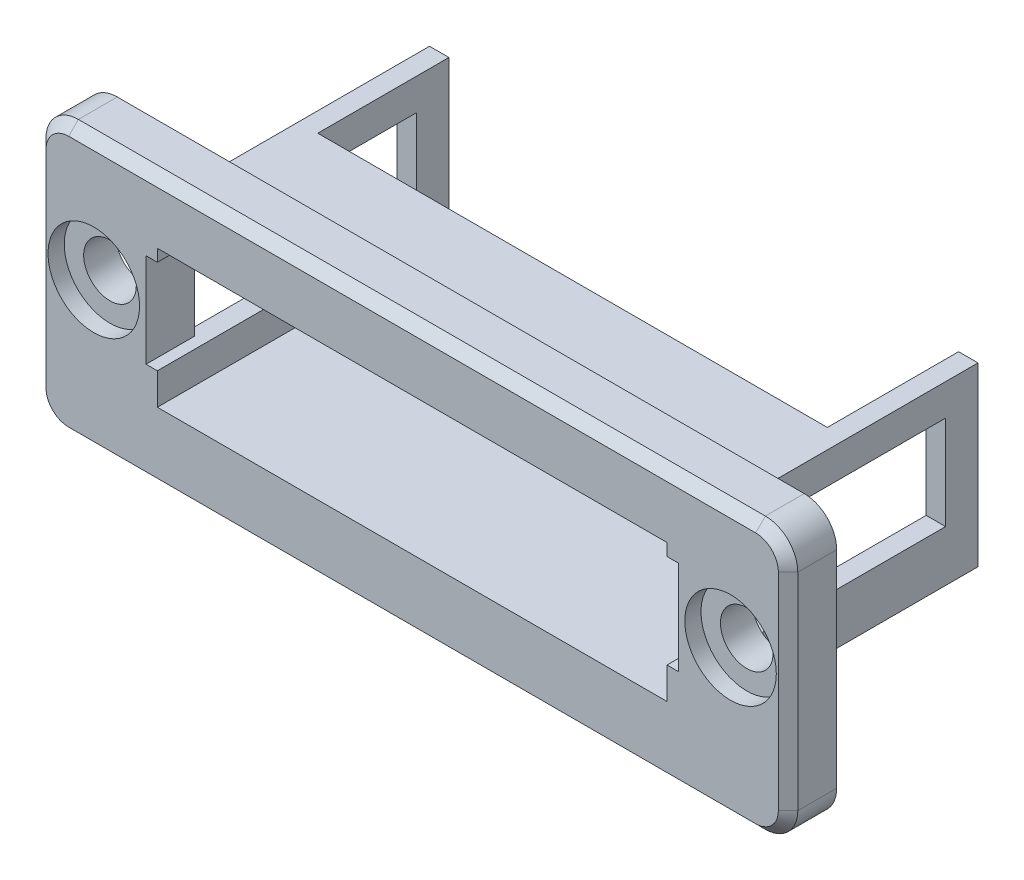
from build123d import *

# Parameters (mm, degrees)
FLANGE_DEPTH             = 3
FRONT_BEVEL_SIZE         = 0.6
OPENING_HOLES_DEPTH      = 26.160177364
OPENING_HOLES_DEPTH_BACK = 26.160177364
SK_OPENING_R             = 1.625
SK_COUNTERBORE_R         = 2.825
COUNTERBORE_DEPTH        = 1
SK_LONG_WALLS_W          = 33.86
SK_LONG_WALLS_H          = 1.2
LONG_WALLS_DEPTH         = 6.9
SK_LEGS_W                = 1.2
SK_LEGS_H                = 1.95
SK_LEGS_H_2              = 3.15
LEGS_DEPTH               = 13
SK_LEG_TIES_W            = 1.2
SK_LEG_TIES_H            = 10.9
LEG_TIES_DEPTH           = 2


with BuildPart() as part:
    # SK Flange → Flange (new body)
    with BuildSketch(Plane.XY):
        with BuildLine():
            Line((-21.205, -9.25), (21.205, -9.25))
            ThreePointArc((21.205, -9.25), (22.619213562, -8.664213562), (23.205, -7.25))
            Line((23.205, -7.25), (23.205, 5.5))
            ThreePointArc((23.205, 5.5), (22.619213562, 6.914213562), (21.205, 7.5))
            Line((21.205, 7.5), (-21.205, 7.5))
            ThreePointArc((-21.205, 7.5), (-22.619213562, 6.914213562), (-23.205, 5.5))
            Line((-23.205, 5.5), (-23.205, -7.25))
            ThreePointArc((-23.205, -7.25), (-22.619213562, -8.664213562), (-21.205, -9.25))
        make_face()
    extrude(amount=FLANGE_DEPTH)

    # Front bevel
    front_bevel_edges = [part.edges().sort_by_distance(p)[0] for p in [
        (22.619213562, -8.664213562, 3),
        (23.205, -0.875, 3),
        (22.619213562, 6.914213562, 3),
        (0, 7.5, 3),
        (-22.619213562, 6.914213562, 3),
        (-23.205, -0.875, 3),
        (-22.619213562, -8.664213562, 3),
        (0, -9.25, 3),
    ]]
    chamfer(front_bevel_edges, length=FRONT_BEVEL_SIZE)

    # SK Opening → Opening + holes (cut, two sides: drawn at the far end of the back side and taken through both)
    with BuildSketch(Plane.XY.offset(-OPENING_HOLES_DEPTH_BACK)):
        with Locations((-19.655, 0)):
            Circle(SK_OPENING_R)
        with Locations((19.655, 0)):
            Circle(SK_OPENING_R)
        Polygon((-15.73, -4.85), (15.73, -4.85), (15.73, -2.9), (16.43, -2.9), (16.43, 2.9), (15.73, 2.9), (15.73, 3.65), (-15.73, 3.65), (-15.73, 2.9), (-16.43, 2.9), (-16.43, -2.9), (-15.73, -2.9), align=None)
    extrude(amount=OPENING_HOLES_DEPTH + OPENING_HOLES_DEPTH_BACK, mode=Mode.SUBTRACT)

    # SK Counterbore → Counterbore (cut)
    with BuildSketch(Plane.XY.offset(3)):
        with Locations((-19.655, 0)):
            Circle(SK_COUNTERBORE_R)
        with Locations((19.655, 0)):
            Circle(SK_COUNTERBORE_R)
    extrude(amount=-COUNTERBORE_DEPTH, mode=Mode.SUBTRACT)

    # SK Long walls → Long walls (add)
    with BuildSketch(Plane.XY):
        with Locations((0, 4.25)):
            Rectangle(SK_LONG_WALLS_W, SK_LONG_WALLS_H)
        with Locations((0, -5.45)):
            Rectangle(SK_LONG_WALLS_W, SK_LONG_WALLS_H)
    extrude(amount=-LONG_WALLS_DEPTH)

    # SK Legs → Legs (add)
    with BuildSketch(Plane.XY):
        with Locations((-16.33, 3.875)):
            Rectangle(SK_LEGS_W, SK_LEGS_H)
        with Locations((-16.33, -4.475)):
            Rectangle(SK_LEGS_W, SK_LEGS_H_2)
        with Locations((16.33, 3.875)):
            Rectangle(SK_LEGS_W, SK_LEGS_H)
        with Locations((16.33, -4.475)):
            Rectangle(SK_LEGS_W, SK_LEGS_H_2)
    extrude(amount=-LEGS_DEPTH)

    # SK Leg ties → Leg ties (add)
    with BuildSketch(Plane.XY.offset(-13)):
        with Locations((-16.33, -0.6)):
            Rectangle(SK_LEG_TIES_W, SK_LEG_TIES_H)
        with Locations((16.33, -0.6)):
            Rectangle(SK_LEG_TIES_W, SK_LEG_TIES_H)
    extrude(amount=-LEG_TIES_DEPTH)


solid = part.part
